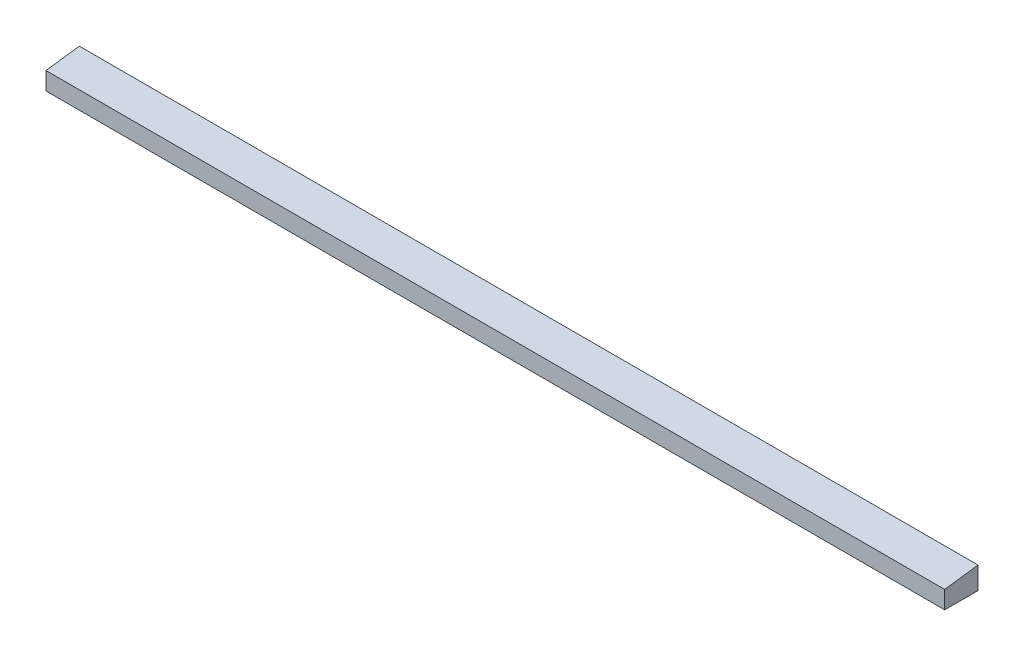
from build123d import *

# Parameters (mm, degrees)
SKETCH1_W           = 514.35
SKETCH1_H           = 12.7
BOSS_EXTRUDE1_DEPTH = 19.05
CUT_EXTRUDE1_DEPTH  = 736.346


with BuildPart() as part:
    # Sketch1 → Boss-Extrude1 (new body)
    with BuildSketch(Plane.XY):
        with Locations((257.175, 6.35)):
            Rectangle(SKETCH1_W, SKETCH1_H)
    extrude(amount=BOSS_EXTRUDE1_DEPTH)

    # Sketch2 → Cut-Extrude1 (cut)
    with BuildSketch(Plane(origin=(514.35, 0, 0), x_dir=(0, 0, -1), z_dir=(1, 0, 0))):
        Polygon((0, 12.7), (-19.05, 10.126312897), (-19.05, 12.7), align=None)
    extrude(amount=-CUT_EXTRUDE1_DEPTH, mode=Mode.SUBTRACT)


solid = part.part
